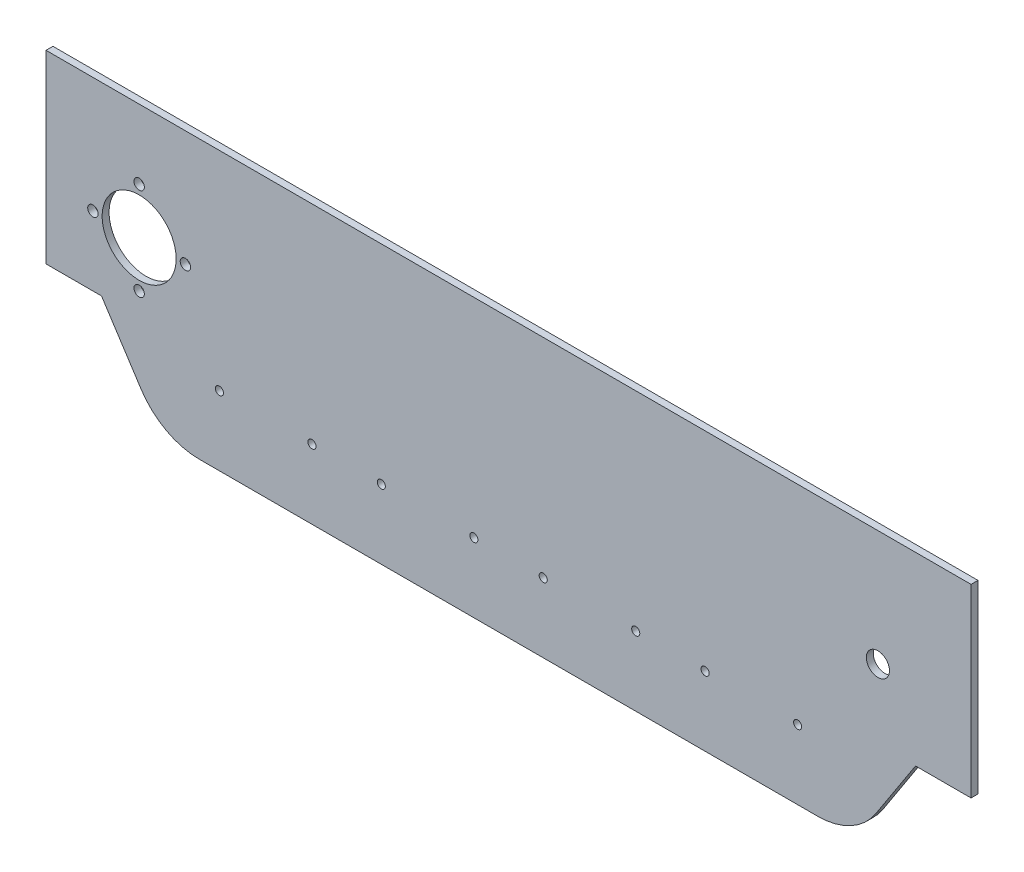
from build123d import *

# Parameters (mm, degrees)
EXTRUDE_1_DEPTH        = 3
SKETCH_3_R             = 16
SKETCH_3_R_2           = 2.25
SKETCH_3_R_3           = 5
CUT_EXTRUDE_3_DEPTH    = 417.901436616
EXTRUDE_START          = -3
EXTRUDE_4_DEPTH        = 3
SKETCH_5_R             = 1.75
CUT_EXTRUDE_5_DEPTH    = 433.011573919
PATTERN_LINEAR_1_COUNT = 4
PATTERN_LINEAR_1_PITCH = 70


with BuildPart() as part:
    # 草圖1 → 伸長1 (new body)
    with BuildSketch(Plane.XY):
        with BuildLine():
            Line((55.280581326, 100), (374.719418674, 100))
            ThreePointArc((374.719418674, 100), (401.086913014, 84.309271198), (399.872727163, 53.650349482))
            Line((399.872727163, 53.650349482), (373.872727163, 13.650349482))
            ThreePointArc((373.872727163, 13.650349482), (363.028689873, 3.63250566), (348.719418674, 0))
            Line((348.719418674, 0), (81.280581326, 0))
            ThreePointArc((81.280581326, 0), (66.971310127, 3.63250566), (56.127272837, 13.650349482))
            Line((56.127272837, 13.650349482), (30.127272837, 53.650349482))
            ThreePointArc((30.127272837, 53.650349482), (28.913086986, 84.309271198), (55.280581326, 100))
        make_face()
    extrude(amount=EXTRUDE_1_DEPTH)

    # 草圖3 → 伸長3 (cut, through all)
    with BuildSketch(Plane.XY.offset(3)):
        with Locations((55.280581326, 70)):
            Circle(SKETCH_3_R)
        with Locations((55.280581326, 90)):
            Circle(SKETCH_3_R_2)
        with Locations((75.280581326, 70)):
            Circle(SKETCH_3_R_2)
        with Locations((55.280581326, 50)):
            Circle(SKETCH_3_R_2)
        with Locations((35.280581326, 70)):
            Circle(SKETCH_3_R_2)
        with Locations((374.719418674, 70)):
            Circle(SKETCH_3_R_3)
    extrude(amount=-CUT_EXTRUDE_3_DEPTH, mode=Mode.SUBTRACT)

    # 草圖4 → 伸長4 (add)
    with BuildSketch(Plane.XY.offset(3).offset(EXTRUDE_START)):
        with BuildLine():
            Line((399.872727163, 53.650349482), (391, 40))
            Line((391, 40), (415, 40))
            Line((415, 40), (415, 120))
            Line((415, 120), (15, 120))
            Line((15, 120), (15, 40))
            Line((15, 40), (39, 40))
            Line((39, 40), (30.127272837, 53.650349482))
            ThreePointArc((30.127272837, 53.650349482), (28.913086986, 84.309271198), (55.280581326, 100))
            Line((55.280581326, 100), (374.719418674, 100))
            ThreePointArc((374.719418674, 100), (401.086913014, 84.309271198), (399.872727163, 53.650349482))
        make_face()
    extrude(amount=EXTRUDE_4_DEPTH)

    # 草圖5 → 伸長5 (cut, through all)
    with BuildSketch(Plane.XY.offset(3)):
        with Locations((130, 30)):
            Circle(SKETCH_5_R)
        with Locations((90, 30)):
            Circle(SKETCH_5_R)
    cut_extrude_5 = extrude(amount=-CUT_EXTRUDE_5_DEPTH, mode=Mode.SUBTRACT)

    # 直線複製排列1: 伸長5 ×4
    with Locations(*[(i * PATTERN_LINEAR_1_PITCH, 0, 0) for i in range(1, PATTERN_LINEAR_1_COUNT)]):
        add(cut_extrude_5, mode=Mode.SUBTRACT)


solid = part.part
